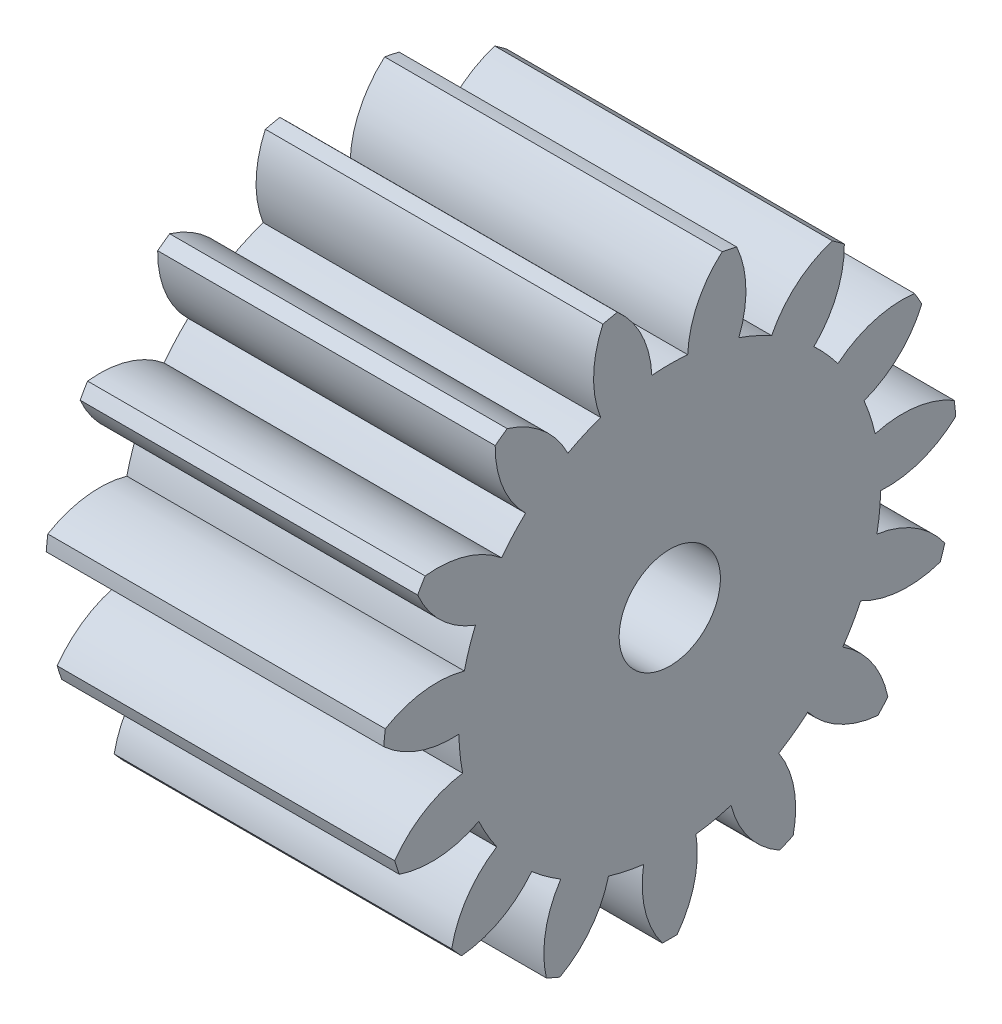
from build123d import *

# Parameters (mm, degrees)
BASPROSKE_W     = 10
BASPROSKE_H     = 8.5
TOOTHCUT_DEPTH  = 16.636495771
TEETHCUTS_COUNT = 15
TEETHCUTS_ANGLE = 336
BORSKE_R        = 1.5
BORE_DEPTH      = 50.0000508


with BuildPart() as part:
    # BasProSke → Base-Revolve (revolve)
    with BuildSketch(Plane(origin=(0, 0, 0), x_dir=(1, 0, 0), z_dir=(0, 1, 0)), mode=Mode.PRIVATE) as base_revolve_sk:
        with Locations((5, 4.25)):
            Rectangle(BASPROSKE_W, BASPROSKE_H)
    revolve(base_revolve_sk.sketch.rotate(Axis((-10, 0, 0), (1, 0, 0)), 180), axis=Axis((-10, 0, 0), (1, 0, 0)))

    # TooCutSke → ToothCut (cut, through all)
    with BuildSketch(Plane(origin=(0, 0, 0), x_dir=(0, 0, -1), z_dir=(1, 0, 0))):
        with BuildLine():
            ThreePointArc((0.531576138, 6.226349477), (0, 6.249), (-0.531576138, 6.226349477))
            ThreePointArc((-0.531576138, 6.226349477), (-0.830301624, 7.411024729), (-1.576608494, 8.378350125))
            ThreePointArc((-1.576608494, 8.378350125), (0, 8.5254), (1.576608494, 8.378350125))
            ThreePointArc((1.576608494, 8.378350125), (0.830301624, 7.411024729), (0.531576138, 6.226349477))
        make_face()
    toothcut = extrude(amount=TOOTHCUT_DEPTH, mode=Mode.SUBTRACT)

    # TeethCuts: ToothCut ×15 about axis
    teethcuts_axis = Axis((-10, 0, 0), (1, 0, 0))
    for i in range(1, TEETHCUTS_COUNT):
        add(toothcut.rotate(teethcuts_axis, i * TEETHCUTS_ANGLE / (TEETHCUTS_COUNT - 1)), mode=Mode.SUBTRACT)

    # BorSke → Bore (cut, symmetric)
    with BuildSketch(Plane(origin=(0, 0, 0), x_dir=(0, 0, -1), z_dir=(1, 0, 0))):
        with Locations(Location((0, 0, 0), (0, 0, 180))):
            Circle(BORSKE_R)
    extrude(amount=BORE_DEPTH, both=True, mode=Mode.SUBTRACT)


solid = part.part
